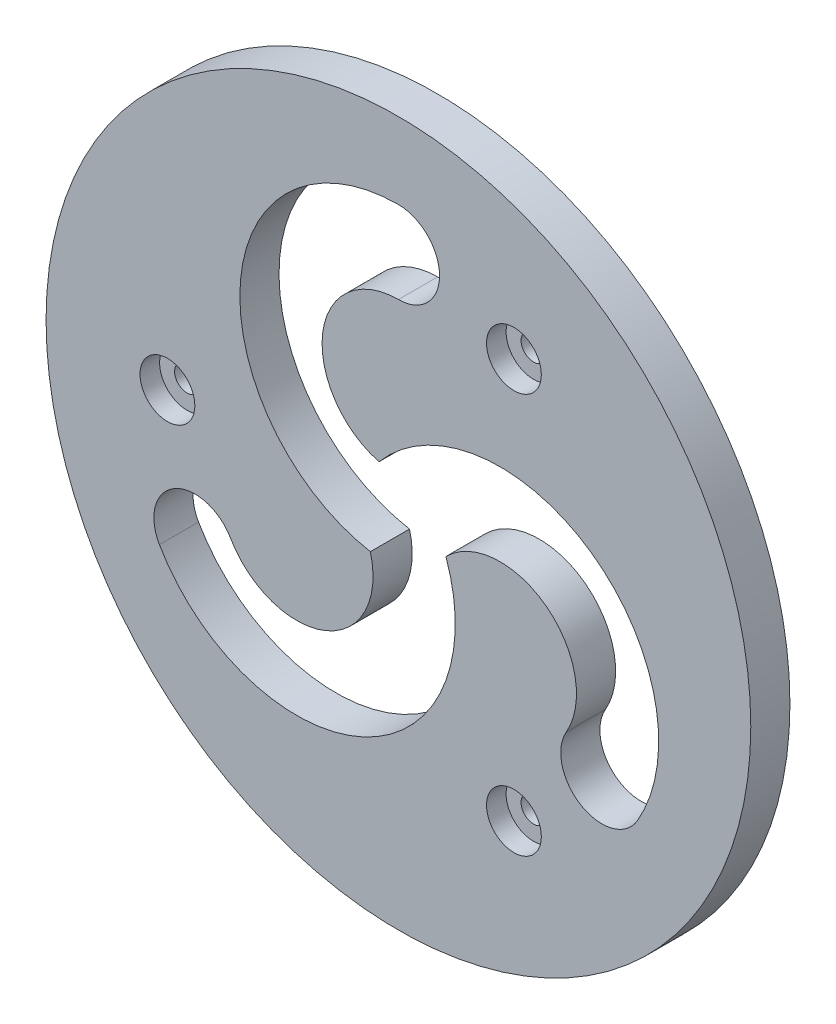
from build123d import *

# Parameters (mm, degrees)
CROQUIS1_R            = 45
DISCO_DEPTH           = 5
PATR_NGIRO_DEPTH      = 64.835726674
CROQUIS7_R            = 1.5875
BARRENOSEJES_DEPTH    = 10
CROQUIS8_R            = 3.5
CORTAR_EXTRUIR5_DEPTH = 2.5


with BuildPart() as part:
    # Croquis1 → Disco (new body)
    with BuildSketch(Plane.XY):
        Circle(CROQUIS1_R)
    extrude(amount=DISCO_DEPTH)

    # Croquis6 → PatrónGiro (cut, through all)
    with BuildSketch(Plane.XY.offset(5)):
        with BuildLine():
            ThreePointArc((-30.527395483, -17.625), (-4.464035413, -25.86746934), (6.062177826, -0.639788633))
            ThreePointArc((6.062177826, -0.639788633), (18.906715666, 0.249805468), (21.434128744, -12.375))
            ThreePointArc((21.434128744, -12.375), (23.355762114, -19.54663337), (30.527395483, -17.625))
            ThreePointArc((30.527395483, -17.625), (24.633903286, 9.067766599), (-2.477015704, 5.569894316))
            ThreePointArc((-2.477015704, 5.569894316), (-9.669695714, 16.248793335), (0, 24.75))
            ThreePointArc((0, 24.75), (5.25, 30), (0, 35.25))
            ThreePointArc((0, 35.25), (-20.169867874, 16.799702741), (-3.585162122, -4.930105684))
            ThreePointArc((-3.585162122, -4.930105684), (-9.237019952, -16.498598803), (-21.434128744, -12.375))
            ThreePointArc((-21.434128744, -12.375), (-28.605762114, -10.45336663), (-30.527395483, -17.625))
        make_face()
    extrude(amount=-PATR_NGIRO_DEPTH, mode=Mode.SUBTRACT)

    # Croquis7 → BarrenosEjes (cut)
    with BuildSketch(Plane.XY.offset(5)):
        with Locations((-29.5, 0)):
            Circle(CROQUIS7_R)
        with Locations((14.75, 25.547749412)):
            Circle(CROQUIS7_R)
        with Locations((14.75, -25.547749412)):
            Circle(CROQUIS7_R)
    extrude(amount=-BARRENOSEJES_DEPTH, mode=Mode.SUBTRACT)

    # Croquis8 → Cortar-Extruir5 (cut)
    with BuildSketch(Plane.XY.offset(5)):
        with Locations((-29.5, 0)):
            Circle(CROQUIS8_R)
        with Locations((14.75, -25.547749412)):
            Circle(CROQUIS8_R)
        with Locations((14.75, 25.547749412)):
            Circle(CROQUIS8_R)
    extrude(amount=-CORTAR_EXTRUIR5_DEPTH, mode=Mode.SUBTRACT)


solid = part.part
